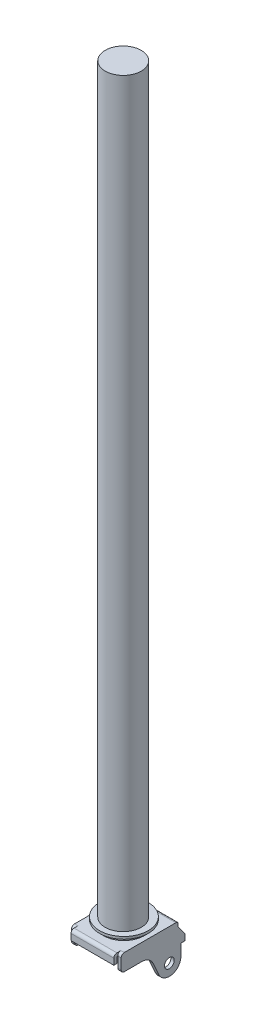
from build123d import *

# Parameters (mm, degrees)
SKETCH1_W           = 35.2425
SKETCH1_H           = 45.085
BOSS_EXTRUDE1_DEPTH = 2.794
SKETCH3_W           = 35.2425
SKETCH3_H           = 7.62
BOSS_EXTRUDE2_DEPTH = 2.794
SKETCH4_W           = 35.2425
SKETCH4_H           = 15.875
BOSS_EXTRUDE3_DEPTH = 2.794
SKETCH5_R           = 3.99415
BOSS_EXTRUDE5_DEPTH = 2.794
SKETCH8_R           = 14.8209
BOSS_EXTRUDE6_DEPTH = 609.6
FILLET1_R           = 2.54


with BuildPart() as part:
    # Sketch1 → Boss-Extrude1 (new body)
    with BuildSketch(Plane(origin=(0, 0, 0), x_dir=(1, 0, 0), z_dir=(0, 1, 0))):
        Rectangle(SKETCH1_W, SKETCH1_H)
    extrude(amount=BOSS_EXTRUDE1_DEPTH)

    # Sketch3 → Boss-Extrude2 (add)
    with BuildSketch(Plane.XY.offset(22.5425)):
        with Locations((0, -1.016)):
            Rectangle(SKETCH3_W, SKETCH3_H)
    extrude(amount=BOSS_EXTRUDE2_DEPTH)

    # Sketch4 → Boss-Extrude3 (add)
    with BuildSketch(Plane(origin=(0, 0, -22.5425), x_dir=(-1, 0, 0), z_dir=(0, 0, -1))):
        with Locations((0, -5.1435)):
            Rectangle(SKETCH4_W, SKETCH4_H)
    extrude(amount=BOSS_EXTRUDE3_DEPTH)

    # Sketch5 → Boss-Extrude5 (add)
    with BuildSketch(Plane.ZY.offset(17.62125)):
        with BuildLine():
            Line((-24.5745, 2.794), (-24.5745, -0.249652205))
            ThreePointArc((-24.5745, -0.249652205), (-24.707295287, -1.060186269), (-25.091795645, -1.785968283))
            Line((-25.091795645, -1.785968283), (-30.3911, -8.763))
            Line((-30.3911, -8.763), (-30.3911, -13.843))
            Line((-30.3911, -13.843), (-26.9875, -13.843))
            Line((-26.9875, -13.843), (-26.9875, -23.3045))
            ThreePointArc((-26.9875, -23.3045), (-19.506235123, -32.571845213), (-8.869629771, -27.213147793))
            Line((-8.869629771, -27.213147793), (-4.188060723, -16.867828085))
            ThreePointArc((-4.188060723, -16.867828085), (-0.439339327, -12.518932794), (5.068277097, -10.8966))
            Line((5.068277097, -10.8966), (19.5707, -10.8966))
            ThreePointArc((19.5707, -10.8966), (21.366751224, -10.152651224), (22.1107, -8.3566))
            Line((22.1107, -8.3566), (22.1107, 0.254))
            ThreePointArc((22.1107, 0.254), (21.366751224, 2.050051224), (19.5707, 2.794))
            Line((19.5707, 2.794), (-24.5745, 2.794))
        make_face()
        with Locations((-17.50695, -23.3045)):
            Circle(SKETCH5_R, mode=Mode.SUBTRACT)
    boss_extrude5 = extrude(amount=BOSS_EXTRUDE5_DEPTH)

    # Mirror1: Boss-Extrude5 across plane
    add(boss_extrude5.mirror(Plane(origin=(0, 0, 0), x_dir=(0, 0, 1), z_dir=(1, 0, 0))))

    # Sketch6 → Revolve1 (revolve)
    with BuildSketch(Plane(origin=(0, 0, 0), x_dir=(0, 0, -1), z_dir=(1, 0, 0))):
        Polygon((0.5588, 2.794), (17.2339, 2.794), (17.2339, 6.1087), (20.5994, 6.1087), (20.5994, 8.1153), (0.5588, 8.1153), align=None)
    revolve(axis=Axis((0, 2.794, -0.5588), (0, 1, 0)))

    # Sketch8 → Boss-Extrude6 (add)
    with BuildSketch(Plane(origin=(0, 8.1153, 0), x_dir=(1, 0, 0), z_dir=(0, 1, 0))):
        with Locations(Location((0, 0, 0), (0, 0, 90))):
            Circle(SKETCH8_R)
    extrude(amount=BOSS_EXTRUDE6_DEPTH)

    # Fillet1
    fillet1_edges = [part.edges().sort_by_distance(p)[0] for p in [
        (0, 2.794, -25.3365),
        (0, 2.794, 25.3365),
    ]]
    fillet(fillet1_edges, radius=FILLET1_R)


solid = part.part
